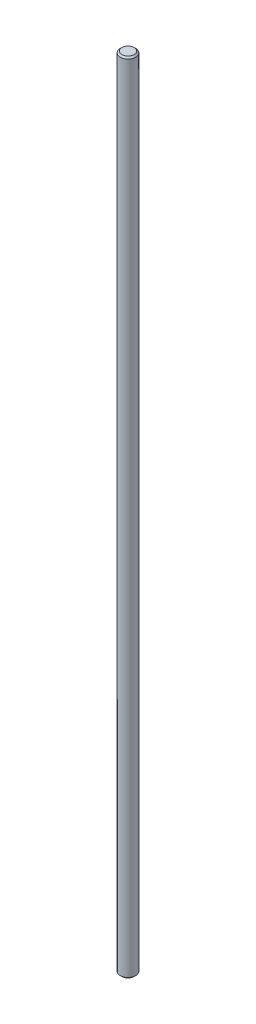
from build123d import *

# Parameters (mm, degrees)
SKETCH1_R           = 5
BOSS_EXTRUDE1_DEPTH = 260
CHAMFER1_SIZE       = 1


with BuildPart() as part:
    # Sketch1 → Boss-Extrude1 (new, symmetric)
    with BuildSketch(Plane(origin=(0, 0, 0), x_dir=(1, 0, 0), z_dir=(0, 1, 0))):
        with Locations(Location((0, 0, 0), (0, 0, 270))):
            Circle(SKETCH1_R)
    extrude(amount=BOSS_EXTRUDE1_DEPTH, both=True)

    # Chamfer1
    chamfer1_edges = [part.edges().sort_by_distance(p)[0] for p in [
        (0, -260, -5),
        (0, 260, -5),
    ]]
    chamfer(chamfer1_edges, length=CHAMFER1_SIZE)


solid = part.part
